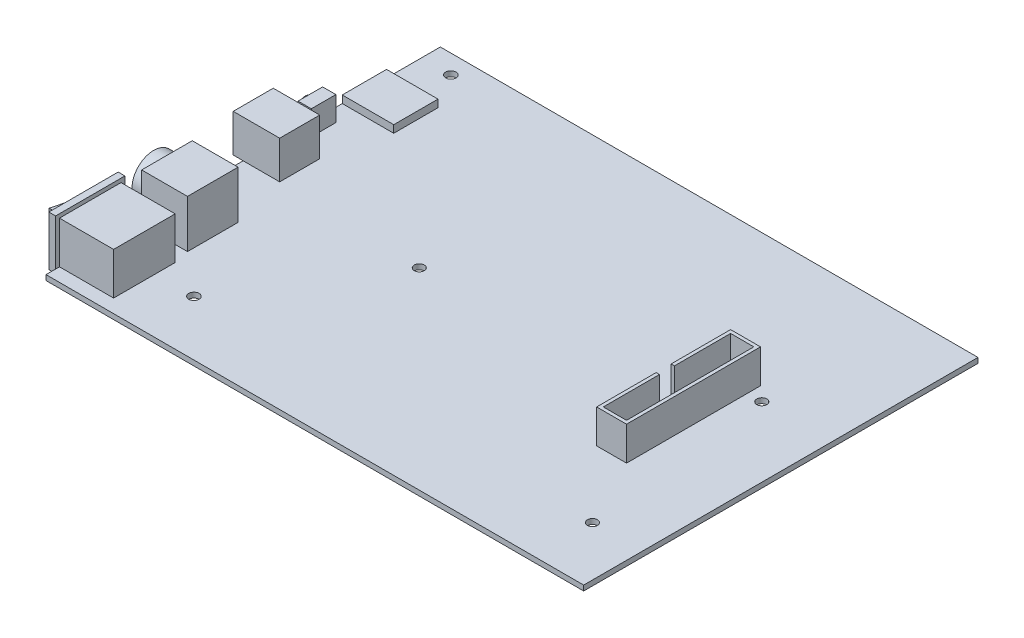
from build123d import *

# Parameters (mm, degrees)
SKETCH1_W            = 161.925
SKETCH1_H            = 118.745
SKETCH1_R            = 1.55
SKETCH1_R_2          = 1.5
BOSS_EXTRUDE1_DEPTH  = 1.56
SKETCH2_W            = 20
SKETCH2_H            = 10.4775
SKETCH2_W_2          = 15.3
SKETCH2_H_2          = 7.62
SKETCH2_W_3          = 11
SKETCH2_H_3          = 6.0325
SKETCH2_W_4          = 15.5
SKETCH2_H_4          = 6.6675
BOSS_EXTRUDE2_DEPTH  = 5
SKETCH4_W            = 17.8
SKETCH4_H            = 15.24
BOSS_EXTRUDE3_DEPTH  = 9.4
SKETCH5_W            = 15.24
SKETCH5_H            = 14.4
SKETCH5_R            = 6.5
CUT_EXTRUDE1_DEPTH   = 4
SKETCH7_W            = 15.5
SKETCH7_H            = 13.335
CUT_EXTRUDE3_DEPTH   = 2.75
SKETCH8_W            = 12.835
SKETCH8_H            = 1.75
CUT_EXTRUDE4_DEPTH   = 15
SKETCH9_W            = 14
SKETCH9_H            = 12.065
BOSS_EXTRUDE4_DEPTH  = 6.4
SKETCH10_W           = 10.065
SKETCH10_H           = 7.4
CUT_EXTRUDE5_DEPTH   = 13
SKETCH11_W           = 9.07
SKETCH11_H           = 2
BOSS_EXTRUDE5_DEPTH  = 13
BOSS_EXTRUDE6_DEPTH  = 5
BOSS_EXTRUDE8_DEPTH  = 4
SKETCH38_W           = 31.093633867
SKETCH38_H           = 25.604360888
CUT_EXTRUDE14_DEPTH  = 10
SKETCH39_W           = 16.3
SKETCH39_H           = 18.54
BOSS_EXTRUDE9_DEPTH  = 12.7
SKETCH40_W           = 1.16
SKETCH40_H           = 1.16
SKETCH40_H_2         = 12.7
BOSS_EXTRUDE10_DEPTH = 2.03
SKETCH41_W           = 13.67
SKETCH41_H           = 9.91
BOSS_EXTRUDE11_DEPTH = 3.51
CUT_EXTRUDE15_DEPTH  = 111.727077745
SKETCH43_W           = 9
SKETCH43_H           = 40.34
BOSS_EXTRUDE12_DEPTH = 10.16
CUT_EXTRUDE16_DEPTH  = 8.66
SKETCH46_W           = 120
SKETCH46_H           = 9.5
SKETCH46_W_2         = 7
SKETCH46_H_2         = 10
SKETCH46_W_3         = 7.773635701
SKETCH46_W_4         = 12
SKETCH46_H_3         = 18
SKETCH46_H_4         = 2.178592617
BOSS_EXTRUDE14_DEPTH = 3
BOSS_EXTRUDE15_DEPTH = 13
SKETCH49_W           = 4
SKETCH49_H           = 7.4
BOSS_EXTRUDE16_DEPTH = 7.31
SKETCH50_R           = 1.75
BOSS_EXTRUDE17_DEPTH = 1.5


with BuildPart() as part:
    # Sketch1 → Boss-Extrude1 (new body)
    with BuildSketch(Plane(origin=(0, 0, 0), x_dir=(1, 0, 0), z_dir=(0, 1, 0))):
        with Locations((10.228253106, -2.102894012)):
            Rectangle(SKETCH1_W, SKETCH1_H)
        with Locations(Location((-42.794246894, -44.860394012, 0), (0, 0, 90))):
            Circle(SKETCH1_R, mode=Mode.SUBTRACT)
        with Locations(Location((-61.844246894, 51.554605988, 0), (0, 0, 90))):
            Circle(SKETCH1_R, mode=Mode.SUBTRACT)
        with Locations(Location((70.205753106, 13.139605988, 0), (0, 0, 90))):
            Circle(SKETCH1_R_2, mode=Mode.SUBTRACT)
        with Locations(Location((-16.294246894, -3.500394012, 0), (0, 0, 90))):
            Circle(SKETCH1_R_2, mode=Mode.SUBTRACT)
        with Locations(Location((76.205753106, -43.860394012, 0), (0, 0, 90))):
            Circle(SKETCH1_R_2, mode=Mode.SUBTRACT)
    extrude(amount=BOSS_EXTRUDE1_DEPTH)

    # Sketch2 → Boss-Extrude2 (add)
    with BuildSketch(Plane(origin=(0, 1.56, 0), x_dir=(1, 0, 0), z_dir=(0, 1, 0))):
        with Locations((-60.734246894, -42.901644012)):
            Rectangle(SKETCH2_W, SKETCH2_H)
        with Locations((-60.734246894, -53.379144012)):
            Rectangle(SKETCH2_W, SKETCH2_H)
        with Locations((-63.084246894, -30.360394012)):
            Rectangle(SKETCH2_W_2, SKETCH2_H_2)
        with Locations((-63.084246894, -22.740394012)):
            Rectangle(SKETCH2_W_2, SKETCH2_H_2)
        Polygon((-70.734246894, -34.170394012), (-70.734246894, -26.550394012), (-70.734246894, -18.930394012), (-73.234246894, -18.930394012), (-73.234246894, -34.170394012), align=None)
        with Locations((-65.234246894, 6.945855988)):
            Rectangle(SKETCH2_W_3, SKETCH2_H_3)
        Polygon((-70.734246894, -2.102894012), (-70.734246894, 3.929605988), (-70.734246894, 9.962105988), (-73.734246894, 9.962105988), (-73.734246894, -2.102894012), align=None)
        with Locations((-65.234246894, 0.913355988)):
            Rectangle(SKETCH2_W_3, SKETCH2_H_3)
        with Locations((-62.984246894, 37.743355988)):
            Rectangle(SKETCH2_W_4, SKETCH2_H_4)
        with Locations((-62.984246894, 31.075855988)):
            Rectangle(SKETCH2_W_4, SKETCH2_H_4)
    extrude(amount=BOSS_EXTRUDE2_DEPTH)

    # Sketch4 → Boss-Extrude3 (add)
    with BuildSketch(Plane(origin=(0, 6.56, 0), x_dir=(1, 0, 0), z_dir=(0, 1, 0))):
        with Locations((-64.334246894, -26.550394012)):
            Rectangle(SKETCH4_W, SKETCH4_H)
    extrude(amount=BOSS_EXTRUDE3_DEPTH)

    # Sketch5 → Cut-Extrude1 (cut)
    with BuildSketch(Plane.ZY.offset(73.234246894)):
        with Locations((26.550394012, 8.76)):
            Rectangle(SKETCH5_W, SKETCH5_H)
        with Locations((26.550394012, 8.76)):
            Circle(SKETCH5_R, mode=Mode.SUBTRACT)
    extrude(amount=-CUT_EXTRUDE1_DEPTH, mode=Mode.SUBTRACT)

    # Sketch7 → Cut-Extrude3 (cut)
    with BuildSketch(Plane(origin=(0, 6.56, 0), x_dir=(1, 0, 0), z_dir=(0, 1, 0))):
        with Locations((-62.984246894, 34.409605988)):
            Rectangle(SKETCH7_W, SKETCH7_H)
    extrude(amount=-CUT_EXTRUDE3_DEPTH, mode=Mode.SUBTRACT)

    # Sketch8 → Cut-Extrude4 (cut)
    with BuildSketch(Plane.ZY.offset(70.734246894)):
        with Locations((-34.409605988, 2.685)):
            Rectangle(SKETCH8_W, SKETCH8_H)
    extrude(amount=-CUT_EXTRUDE4_DEPTH, mode=Mode.SUBTRACT)

    # Sketch9 → Boss-Extrude4 (add)
    with BuildSketch(Plane(origin=(0, 6.56, 0), x_dir=(1, 0, 0), z_dir=(0, 1, 0))):
        with Locations((-66.734246894, 3.929605988)):
            Rectangle(SKETCH9_W, SKETCH9_H)
    extrude(amount=BOSS_EXTRUDE4_DEPTH)

    # Sketch10 → Cut-Extrude5 (cut)
    with BuildSketch(Plane.ZY.offset(73.734246894)):
        with Locations((-3.929605988, 7.26)):
            Rectangle(SKETCH10_W, SKETCH10_H)
    extrude(amount=-CUT_EXTRUDE5_DEPTH, mode=Mode.SUBTRACT)

    # Sketch11 → Boss-Extrude5 (add)
    with BuildSketch(Plane.ZY.offset(60.734246894)):
        with Locations((-3.927105988, 6.46)):
            Rectangle(SKETCH11_W, SKETCH11_H)
    extrude(amount=BOSS_EXTRUDE5_DEPTH)

    # Sketch12 → Boss-Extrude6 (add)
    with BuildSketch(Plane(origin=(0, 6.56, 0), x_dir=(1, 0, 0), z_dir=(0, 1, 0))):
        Polygon((-70.734246894, -58.617894012), (-71.734246894, -58.617894012), (-71.734246894, -60.117894012), (-73.734246894, -60.117894012), (-73.806970959, -36.162894012), (-71.734246894, -36.162894012), (-71.734246894, -37.662894012), (-70.734246894, -37.662894012), align=None)
    extrude(amount=-BOSS_EXTRUDE6_DEPTH)

    # Sketch13 → Boss-Extrude8 (add)
    with BuildSketch(Plane(origin=(0, 6.56, 0), x_dir=(1, 0, 0), z_dir=(0, 1, 0))):
        Polygon((-50.734246894, -37.662894012), (-50.734246894, -58.617894012), (-71.734246894, -58.617894012), (-71.734246894, -60.117894012), (-73.734246894, -60.117894012), (-73.806970959, -36.162894012), (-71.734246894, -36.162894012), (-71.734246894, -37.662894012), align=None)
    extrude(amount=BOSS_EXTRUDE8_DEPTH)

    # Sketch38 → Cut-Extrude14 (cut)
    with BuildSketch(Plane(origin=(0, 1.56, 0), x_dir=(1, 0, 0), z_dir=(0, 1, 0))):
        with Locations((-64.389815501, -47.792725567)):
            Rectangle(SKETCH38_W, SKETCH38_H)
    extrude(amount=CUT_EXTRUDE14_DEPTH, mode=Mode.SUBTRACT)

    # Sketch39 → Boss-Extrude9 (add)
    with BuildSketch(Plane(origin=(0, 1.56, 0), x_dir=(1, 0, 0), z_dir=(0, 1, 0))):
        with Locations((-62.584246894, -48.145394012)):
            Rectangle(SKETCH39_W, SKETCH39_H)
    extrude(amount=BOSS_EXTRUDE9_DEPTH)

    # Sketch40 → Boss-Extrude10 (add)
    with BuildSketch(Plane.ZY.offset(70.734246894)):
        with Locations((38.295394012, 14.84)):
            Rectangle(SKETCH40_W, SKETCH40_H)
        Polygon((38.875394012, 15.42), (38.875394012, 14.26), (57.415394012, 14.26), (57.415394012, 1.56), (58.575394012, 1.56), (58.575394012, 15.42), align=None)
        with Locations((38.295394012, 7.91)):
            Rectangle(SKETCH40_W, SKETCH40_H_2)
        Polygon((57.415394012, 14.26), (38.875394012, 14.26), (38.875394012, 1.56), (37.715394012, 1.56), (37.715394012, 0.4), (57.415394012, 0.4), (57.415394012, 1.56), align=None)
        with Locations((57.995394012, 0.98)):
            Rectangle(SKETCH40_W, SKETCH40_H)
    extrude(amount=BOSS_EXTRUDE10_DEPTH)

    # Sketch41 → Boss-Extrude11 (add)
    with BuildSketch(Plane.ZY.offset(72.764246894)):
        with Locations((48.145394012, 7.91)):
            Rectangle(SKETCH41_W, SKETCH41_H)
    extrude(amount=BOSS_EXTRUDE11_DEPTH)

    # Sketch42 → Cut-Extrude15 (cut, through all)
    with BuildSketch(Plane(origin=(0, 12.865, 0), x_dir=(1, 0, 0), z_dir=(0, 1, 0))):
        Polygon((-72.764246894, -41.310394012), (-76.274246894, -54.980394012), (-76.274246894, -41.310394012), align=None)
    extrude(amount=-CUT_EXTRUDE15_DEPTH, mode=Mode.SUBTRACT)

    # Sketch43 → Boss-Extrude12 (add)
    with BuildSketch(Plane(origin=(0, 1.56, 0), x_dir=(1, 0, 0), z_dir=(0, 1, 0))):
        with Locations((61.345753106, -3.060394012)):
            Rectangle(SKETCH43_W, SKETCH43_H)
    extrude(amount=BOSS_EXTRUDE12_DEPTH)

    # Sketch44 → Cut-Extrude16 (cut)
    with BuildSketch(Plane(origin=(0, 11.72, 0), x_dir=(1, 0, 0), z_dir=(0, 1, 0))):
        Polygon((57.845753106, -0.810394012), (56.845753106, -0.810394012), (56.845753106, -5.310394012), (57.845753106, -5.310394012), (57.845753106, -22.230394012), (64.845753106, -22.230394012), (64.845753106, 16.109605988), (57.845753106, 16.109605988), align=None)
    extrude(amount=-CUT_EXTRUDE16_DEPTH, mode=Mode.SUBTRACT)

    # Sketch46 → Boss-Extrude14 (add)
    with BuildSketch(Plane.XZ):
        with Locations((19.265753106, -47.519605988)):
            Rectangle(SKETCH46_W, SKETCH46_H)
        with Locations((-67.234246894, -19.269605988)):
            Rectangle(SKETCH46_W_2, SKETCH46_H_2)
        with Locations((-41.847429044, -19.269605988)):
            Rectangle(SKETCH46_W_3, SKETCH46_H_2)
        with Locations((-64.734246894, -2.132030476)):
            Rectangle(SKETCH46_W_4, SKETCH46_H_3)
        with Locations((-45.018245774, 0.319690321)):
            Rectangle(SKETCH46_W_2, SKETCH46_H_4)
    extrude(amount=BOSS_EXTRUDE14_DEPTH)

    # Sketch47 → Boss-Extrude15 (add)
    with BuildSketch(Plane.ZY.offset(73.734246894)):
        Polygon((-6.929605988, 10.96), (-8.962105988, 8.9275), (-8.962105988, 10.96), align=None)
        Polygon((-0.929605988, 10.96), (1.102894012, 8.9275), (1.102894012, 10.96), align=None)
    extrude(amount=-BOSS_EXTRUDE15_DEPTH)

    # Sketch49 → Boss-Extrude16 (add)
    with BuildSketch(Plane(origin=(0, 1.56, 0), x_dir=(1, 0, 0), z_dir=(0, 1, 0))):
        with Locations((-68.734246894, 18.124605988)):
            Rectangle(SKETCH49_W, SKETCH49_H)
    extrude(amount=BOSS_EXTRUDE16_DEPTH)

    # Sketch50 → Boss-Extrude17 (add)
    with BuildSketch(Plane.ZY.offset(70.734246894)):
        with Locations(Location((-18.124605988, 5.87, 0), (0, 0, 180))):
            Circle(SKETCH50_R)
    extrude(amount=BOSS_EXTRUDE17_DEPTH)


solid = part.part
